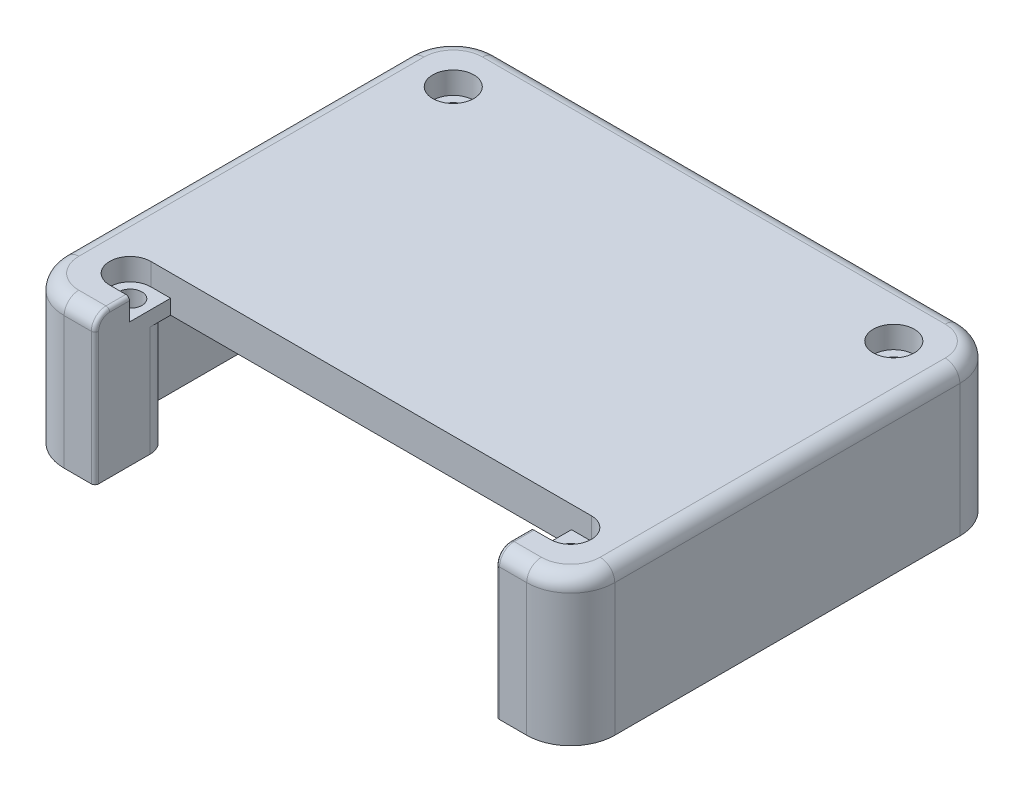
from build123d import *

# Parameters (mm, degrees)
SKETCH2_R           = 1.6
BOSS_EXTRUDE1_DEPTH = 15
SKETCH3_R           = 1.6
BOSS_EXTRUDE2_DEPTH = 5
SKETCH4_R           = 2.8
CUT_EXTRUDE1_DEPTH  = 3
FILLET3_R           = 2
FILLET4_R           = 0.5


with BuildPart() as part:
    # Sketch2 → Boss-Extrude1 (new body)
    # profile 1 of 5: a face of its own
    with BuildSketch(Plane(origin=(0, 5.1, 0), x_dir=(1, 0, 0), z_dir=(0, 1, 0))):
        with BuildLine():
            Line((-27.3, -29.5), (-27.3, -25.1))
            Line((-27.3, -25.1), (-30.1, -25.1))
            ThreePointArc((-30.1, -25.1), (-32.221320344, -24.221320344), (-33.1, -22.1))
            Line((-33.1, -22.1), (-33.1, -18.8))
            Line((-33.1, -18.8), (-33.1, 18.5))
            Line((-33.1, 18.5), (-33.1, 22.1))
            ThreePointArc((-33.1, 22.1), (-32.221320344, 24.221320344), (-30.1, 25.1))
            Line((-30.1, 25.1), (-26.5, 25.1))
            Line((-26.5, 25.1), (26.5, 25.1))
            Line((26.5, 25.1), (30.1, 25.1))
            ThreePointArc((30.1, 25.1), (32.221320344, 24.221320344), (33.1, 22.1))
            Line((33.1, 22.1), (33.1, 18.5))
            Line((33.1, 18.5), (33.1, -18.8))
            Line((33.1, -18.8), (33.1, -22.1))
            ThreePointArc((33.1, -22.1), (32.221320344, -24.221320344), (30.1, -25.1))
            Line((30.1, -25.1), (27.3, -25.1))
            Line((27.3, -25.1), (27.3, -29.5))
            Line((27.3, -29.5), (31.5, -29.5))
            ThreePointArc((31.5, -29.5), (35.742640687, -27.742640687), (37.5, -23.5))
            Line((37.5, -23.5), (37.5, 23.5))
            ThreePointArc((37.5, 23.5), (35.742640687, 27.742640687), (31.5, 29.5))
            Line((31.5, 29.5), (-31.5, 29.5))
            ThreePointArc((-31.5, 29.5), (-35.742640687, 27.742640687), (-37.5, 23.5))
            Line((-37.5, 23.5), (-37.5, -23.5))
            ThreePointArc((-37.5, -23.5), (-35.742640687, -27.742640687), (-31.5, -29.5))
            Line((-31.5, -29.5), (-27.3, -29.5))
        make_face()
    # profile 2 of 5: a face of its own
    with BuildSketch(Plane(origin=(0, 5.1, 0), x_dir=(1, 0, 0), z_dir=(0, 1, 0))):
        with BuildLine():
            Line((-33.1, 22.1), (-33.1, 18.5))
            ThreePointArc((-33.1, 18.5), (-32.953553391, 18.853553391), (-32.6, 19))
            Line((-32.6, 19), (-30, 19))
            ThreePointArc((-30, 19), (-27.878679656, 19.878679656), (-27, 22))
            Line((-27, 22), (-27, 24.6))
            ThreePointArc((-27, 24.6), (-26.853553391, 24.953553391), (-26.5, 25.1))
            Line((-26.5, 25.1), (-30.1, 25.1))
            ThreePointArc((-30.1, 25.1), (-32.221320344, 24.221320344), (-33.1, 22.1))
        make_face()
        with Locations(Location((-30, 22, 0), (0, 0, 270))):
            Circle(SKETCH2_R, mode=Mode.SUBTRACT)
    # profile 3 of 5: a face of its own
    with BuildSketch(Plane(origin=(0, 5.1, 0), x_dir=(1, 0, 0), z_dir=(0, 1, 0))):
        with BuildLine():
            ThreePointArc((32.6, 19), (32.953553391, 18.853553391), (33.1, 18.5))
            Line((33.1, 18.5), (33.1, 22.1))
            ThreePointArc((33.1, 22.1), (32.221320344, 24.221320344), (30.1, 25.1))
            Line((30.1, 25.1), (26.5, 25.1))
            ThreePointArc((26.5, 25.1), (26.853553391, 24.953553391), (27, 24.6))
            Line((27, 24.6), (27, 22))
            ThreePointArc((27, 22), (27.878679656, 19.878679656), (30, 19))
            Line((30, 19), (32.6, 19))
        make_face()
        with Locations(Location((30, 22, 0), (0, 0, 270))):
            Circle(SKETCH2_R, mode=Mode.SUBTRACT)
    # profile 4 of 5: a face of its own
    with BuildSketch(Plane(origin=(0, 5.1, 0), x_dir=(1, 0, 0), z_dir=(0, 1, 0))):
        with BuildLine():
            Line((27.3, -22), (27.3, -25.1))
            Line((27.3, -25.1), (30.1, -25.1))
            ThreePointArc((30.1, -25.1), (32.221320344, -24.221320344), (33.1, -22.1))
            Line((33.1, -22.1), (33.1, -18.8))
            ThreePointArc((33.1, -18.8), (32.953553391, -19.153553391), (32.6, -19.3))
            Line((32.6, -19.3), (30, -19.3))
            ThreePointArc((30, -19.3), (28.090811691, -20.090811691), (27.3, -22))
        make_face()
        with Locations(Location((30, -22, 0), (0, 0, 270))):
            Circle(SKETCH2_R, mode=Mode.SUBTRACT)
    # profile 5 of 5: a face of its own
    with BuildSketch(Plane(origin=(0, 5.1, 0), x_dir=(1, 0, 0), z_dir=(0, 1, 0))):
        with BuildLine():
            Line((-27.3, -25.1), (-27.3, -22))
            ThreePointArc((-27.3, -22), (-28.090811691, -20.090811691), (-30, -19.3))
            Line((-30, -19.3), (-32.6, -19.3))
            ThreePointArc((-32.6, -19.3), (-32.953553391, -19.153553391), (-33.1, -18.8))
            Line((-33.1, -18.8), (-33.1, -22.1))
            ThreePointArc((-33.1, -22.1), (-32.221320344, -24.221320344), (-30.1, -25.1))
            Line((-30.1, -25.1), (-27.3, -25.1))
        make_face()
        with Locations(Location((-30, -22, 0), (0, 0, 270))):
            Circle(SKETCH2_R, mode=Mode.SUBTRACT)
    extrude(amount=BOSS_EXTRUDE1_DEPTH)

    # Sketch3 → Boss-Extrude2 (add)
    # profile 1 of 2: a face of its own
    with BuildSketch(Plane(origin=(0, 20.1, 0), x_dir=(1, 0, 0), z_dir=(0, 1, 0))):
        with BuildLine():
            ThreePointArc((-30, -19.3), (-28.090811691, -20.090811691), (-27.3, -22))
            Line((-27.3, -22), (-27.3, -19.2))
            Line((-27.3, -19.2), (27.3, -19.2))
            Line((27.3, -19.2), (27.3, -22))
            ThreePointArc((27.3, -22), (28.090811691, -20.090811691), (30, -19.3))
            Line((30, -19.3), (32.6, -19.3))
            ThreePointArc((32.6, -19.3), (32.953553391, -19.153553391), (33.1, -18.8))
            Line((33.1, -18.8), (33.1, 18.5))
            ThreePointArc((33.1, 18.5), (32.953553391, 18.853553391), (32.6, 19))
            Line((32.6, 19), (30, 19))
            ThreePointArc((30, 19), (27.878679656, 19.878679656), (27, 22))
            Line((27, 22), (27, 24.6))
            ThreePointArc((27, 24.6), (26.853553391, 24.953553391), (26.5, 25.1))
            Line((26.5, 25.1), (-26.5, 25.1))
            ThreePointArc((-26.5, 25.1), (-26.853553391, 24.953553391), (-27, 24.6))
            Line((-27, 24.6), (-27, 22))
            ThreePointArc((-27, 22), (-27.878679656, 19.878679656), (-30, 19))
            Line((-30, 19), (-32.6, 19))
            ThreePointArc((-32.6, 19), (-32.953553391, 18.853553391), (-33.1, 18.5))
            Line((-33.1, 18.5), (-33.1, -18.8))
            ThreePointArc((-33.1, -18.8), (-32.953553391, -19.153553391), (-32.6, -19.3))
            Line((-32.6, -19.3), (-30, -19.3))
        make_face()
    # profile 2 of 2: a face of its own
    with BuildSketch(Plane(origin=(0, 20.1, 0), x_dir=(1, 0, 0), z_dir=(0, 1, 0))):
        with BuildLine():
            Line((32.6, -19.3), (30, -19.3))
            ThreePointArc((30, -19.3), (28.090811691, -20.090811691), (27.3, -22))
            Line((27.3, -22), (27.3, -29.5))
            Line((27.3, -29.5), (31.5, -29.5))
            ThreePointArc((31.5, -29.5), (35.742640687, -27.742640687), (37.5, -23.5))
            Line((37.5, -23.5), (37.5, 23.5))
            ThreePointArc((37.5, 23.5), (35.742640687, 27.742640687), (31.5, 29.5))
            Line((31.5, 29.5), (-31.5, 29.5))
            ThreePointArc((-31.5, 29.5), (-35.742640687, 27.742640687), (-37.5, 23.5))
            Line((-37.5, 23.5), (-37.5, -23.5))
            ThreePointArc((-37.5, -23.5), (-35.742640687, -27.742640687), (-31.5, -29.5))
            Line((-31.5, -29.5), (-27.3, -29.5))
            Line((-27.3, -29.5), (-27.3, -22))
            ThreePointArc((-27.3, -22), (-28.090811691, -20.090811691), (-30, -19.3))
            Line((-30, -19.3), (-32.6, -19.3))
            ThreePointArc((-32.6, -19.3), (-32.953553391, -19.153553391), (-33.1, -18.8))
            Line((-33.1, -18.8), (-33.1, 18.5))
            ThreePointArc((-33.1, 18.5), (-32.953553391, 18.853553391), (-32.6, 19))
            Line((-32.6, 19), (-30, 19))
            ThreePointArc((-30, 19), (-27.878679656, 19.878679656), (-27, 22))
            Line((-27, 22), (-27, 24.6))
            ThreePointArc((-27, 24.6), (-26.853553391, 24.953553391), (-26.5, 25.1))
            Line((-26.5, 25.1), (26.5, 25.1))
            ThreePointArc((26.5, 25.1), (26.853553391, 24.953553391), (27, 24.6))
            Line((27, 24.6), (27, 22))
            ThreePointArc((27, 22), (27.878679656, 19.878679656), (30, 19))
            Line((30, 19), (32.6, 19))
            ThreePointArc((32.6, 19), (32.953553391, 18.853553391), (33.1, 18.5))
            Line((33.1, 18.5), (33.1, -18.8))
            ThreePointArc((33.1, -18.8), (32.953553391, -19.153553391), (32.6, -19.3))
        make_face()
        with Locations(Location((30, -22, 0), (0, 0, 270))):
            Circle(SKETCH3_R, mode=Mode.SUBTRACT)
        with Locations(Location((-30, 22, 0), (0, 0, 270))):
            Circle(SKETCH3_R, mode=Mode.SUBTRACT)
        with Locations(Location((-30, -22, 0), (0, 0, 270))):
            Circle(SKETCH3_R, mode=Mode.SUBTRACT)
        with Locations(Location((30, 22, 0), (0, 0, 270))):
            Circle(SKETCH3_R, mode=Mode.SUBTRACT)
    extrude(amount=BOSS_EXTRUDE2_DEPTH)

    # Sketch4 → Cut-Extrude1 (cut)
    with BuildSketch(Plane(origin=(0, 25.1, 0), x_dir=(1, 0, 0), z_dir=(0, 1, 0))):
        with Locations(Location((-30, 22, 0), (0, 0, 270))):
            Circle(SKETCH4_R)
        with Locations(Location((30, 22, 0), (0, 0, 90))):
            Circle(SKETCH4_R)
        with BuildLine():
            Line((-30, -19.2), (-27.3, -19.2))
            Line((-27.3, -19.2), (-27.3, -24.8))
            Line((-27.3, -24.8), (-30, -24.8))
            ThreePointArc((-30, -24.8), (-32.8, -22), (-30, -19.2))
        make_face()
        with BuildLine():
            Line((27.3, -19.2), (27.3, -24.8))
            Line((27.3, -24.8), (30, -24.8))
            ThreePointArc((30, -24.8), (32.8, -22), (30, -19.2))
            Line((30, -19.2), (27.3, -19.2))
        make_face()
    extrude(amount=-CUT_EXTRUDE1_DEPTH, mode=Mode.SUBTRACT)

    # Fillet3
    fillet3_edges = [part.edges().sort_by_distance(p)[0] for p in [
        (29.4, 25.1, 29.5),
        (35.742640687, 25.1, 27.742640687),
        (37.5, 25.1, 0),
        (35.742640687, 25.1, -27.742640687),
        (0, 25.1, -29.5),
        (-35.742640687, 25.1, -27.742640687),
        (-37.5, 25.1, 0),
        (-35.742640687, 25.1, 27.742640687),
        (-29.4, 25.1, 29.5),
    ]]
    fillet(fillet3_edges, radius=FILLET3_R)

    # Fillet4
    fillet4_edges = [part.edges().sort_by_distance(p)[0] for p in [
        (27.3, 25.1, 26.15),
        (-27.3, 25.1, 26.15),
        (27.3, 14.1, 29.5),
        (27.3, 24.514213562, 28.914213562),
        (-27.3, 14.1, 29.5),
        (-27.3, 24.514213562, 28.914213562),
    ]]
    fillet(fillet4_edges, radius=FILLET4_R)


solid = part.part
